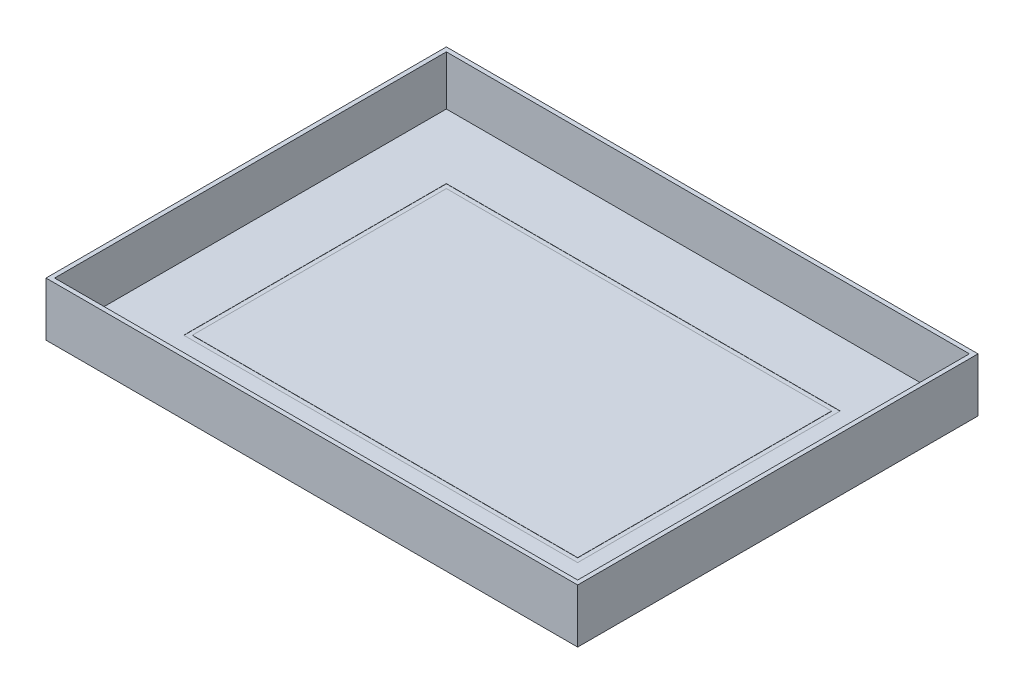
from build123d import *

# Parameters (mm, degrees)
SKETCH_1_W      = 2470
SKETCH_1_H      = 1860
SKETCH_1_W_2    = 2430
SKETCH_1_H_2    = 1820
EXTRUDE_1_DEPTH = 230
SKETCH_2_W      = 2470
SKETCH_2_H      = 1860
EXTRUDE_2_DEPTH = 20
SKETCH_3_R      = 0.0001
EXTRUDE_3_DEPTH = 1


with BuildPart() as part:
    # Эскиз1 → Выдавливание1 (new body)
    with BuildSketch(Plane(origin=(0, 0, 0), x_dir=(-1, 0, 0), z_dir=(0, 1, 0))):
        Rectangle(SKETCH_1_W, SKETCH_1_H)
        Rectangle(SKETCH_1_W_2, SKETCH_1_H_2, mode=Mode.SUBTRACT)
    extrude(amount=EXTRUDE_1_DEPTH)

    # Эскиз2 → Выдавливание2 (add)
    with BuildSketch(Plane(origin=(0, 0, 0), x_dir=(-1, 0, 0), z_dir=(0, 1, 0))):
        Rectangle(SKETCH_2_W, SKETCH_2_H)
    extrude(amount=-EXTRUDE_2_DEPTH)

    # Эскиз3 → Выдавливание3 (cut)
    with BuildSketch(Plane(origin=(0, 0, 0), x_dir=(-1, 0, 0), z_dir=(0, 1, 0))):
        Polygon((-915, 610), (-915, 0.0001), (-915, -610), (915, -610), (915, 0.0001), (915, 610), align=None)
        with Locations((914.9999, 0.0001)):
            Circle(SKETCH_3_R, mode=Mode.SUBTRACT)
        with Locations((895.0001, 0.0001)):
            Circle(SKETCH_3_R, mode=Mode.SUBTRACT)
        with Locations((-895.0001, 0.0001)):
            Circle(SKETCH_3_R, mode=Mode.SUBTRACT)
        with Locations((-914.9999, 0.0001)):
            Circle(SKETCH_3_R, mode=Mode.SUBTRACT)
        with Locations((895.0001, -0.0001)):
            Circle(SKETCH_3_R, mode=Mode.SUBTRACT)
        with Locations((914.9999, -0.0001)):
            Circle(SKETCH_3_R, mode=Mode.SUBTRACT)
        with Locations((-914.9999, -0.0001)):
            Circle(SKETCH_3_R, mode=Mode.SUBTRACT)
        with Locations((-895.0001, -0.0001)):
            Circle(SKETCH_3_R, mode=Mode.SUBTRACT)
        Polygon((-895, 0.0001), (-895, 590), (895, 590), (895, 0.0001), (895, -590), (-895, -590), align=None, mode=Mode.SUBTRACT)
    extrude(amount=-EXTRUDE_3_DEPTH, mode=Mode.SUBTRACT)


solid = part.part
